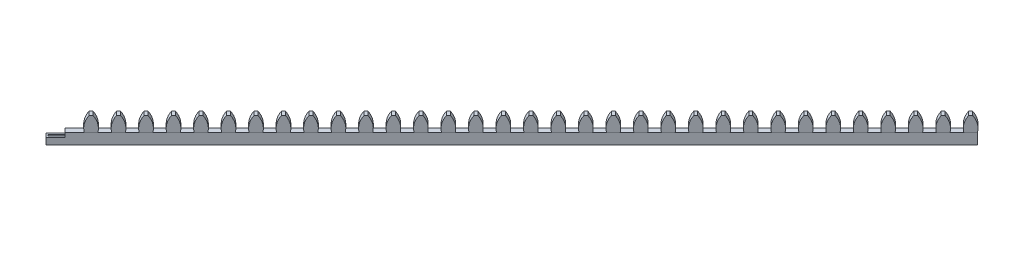
from build123d import *

# Parameters (mm, degrees)
BOSS_EXTRUDE1_DEPTH = 5
BOSS_EXTRUDE2_DEPTH = 2.5
LPATTERN1_COUNT     = 33
LPATTERN1_PITCH     = 9
CUT_EXTRUDE1_DEPTH  = 6.5
CUT_EXTRUDE2_DEPTH  = 2


with BuildPart() as part:
    # Sketch1 → Boss-Extrude1 (new body)
    with BuildSketch(Plane(origin=(0, 0, 0), x_dir=(1, 0, 0), z_dir=(0, 1, 0))):
        Polygon((0, 0), (215.667568262, 215.667568262), (213.899801309, 217.435335215), (-1.767766953, 1.767766953), align=None)
    extrude(amount=BOSS_EXTRUDE1_DEPTH)

    # Sketch4 → Cut-Extrude1 (cut)
    with BuildSketch(Plane(origin=(0, 5, 0), x_dir=(1, 0, 0), z_dir=(0, 1, 0))):
        Polygon((3.111269837, 5.656854249), (-0.777817459, 1.767766953), (0, 0.989949494), (3.889087297, 4.87903679), align=None)
    extrude(amount=-CUT_EXTRUDE1_DEPTH, mode=Mode.SUBTRACT)

    # Sketch4<4> → Cut-Extrude2 (cut)
    with BuildSketch(Plane(origin=(0, 5, 0), x_dir=(1, 0, 0), z_dir=(0, 1, 0))):
        Polygon((2.61629509, 6.151828996), (-1.767766953, 1.767766953), (0, 0), (4.384062043, 4.384062043), (3.889087297, 4.87903679), (0, 0.989949494), (-0.777817459, 1.767766953), (3.111269837, 5.656854249), align=None)
    extrude(amount=-CUT_EXTRUDE2_DEPTH, mode=Mode.SUBTRACT)


with BuildPart() as body_2:
    # Sketch3 → Boss-Extrude2 (new body)
    with BuildSketch(Plane(origin=(-1.767766953, 0, -1.767766953), x_dir=(-0.7071067811865475, 0, 0.7071067811865477), z_dir=(-0.7071067811865477, 0, -0.7071067811865475))):
        with BuildLine():
            Line((-300.5, 5), (-305, 5))
            ThreePointArc((-305, 5), (-304.931089317, 8.570673306), (-303.385, 11.79))
            ThreePointArc((-303.385, 11.79), (-302.75, 11.798401992), (-302.115, 11.79))
            ThreePointArc((-302.115, 11.79), (-300.568910683, 8.570673306), (-300.5, 5))
        make_face()
    boss_extrude2 = extrude(amount=-BOSS_EXTRUDE2_DEPTH)


with BuildPart() as lpattern1_1:
    # LPattern1: Boss-Extrude2 ×33
    with Locations(*[Vector(-0.7071067811865476, 0, 0.7071067811865476) * (i * LPATTERN1_PITCH) for i in range(1, LPATTERN1_COUNT)]):
        add(boss_extrude2)


solid = Compound([part.part, body_2.part, lpattern1_1.part])
